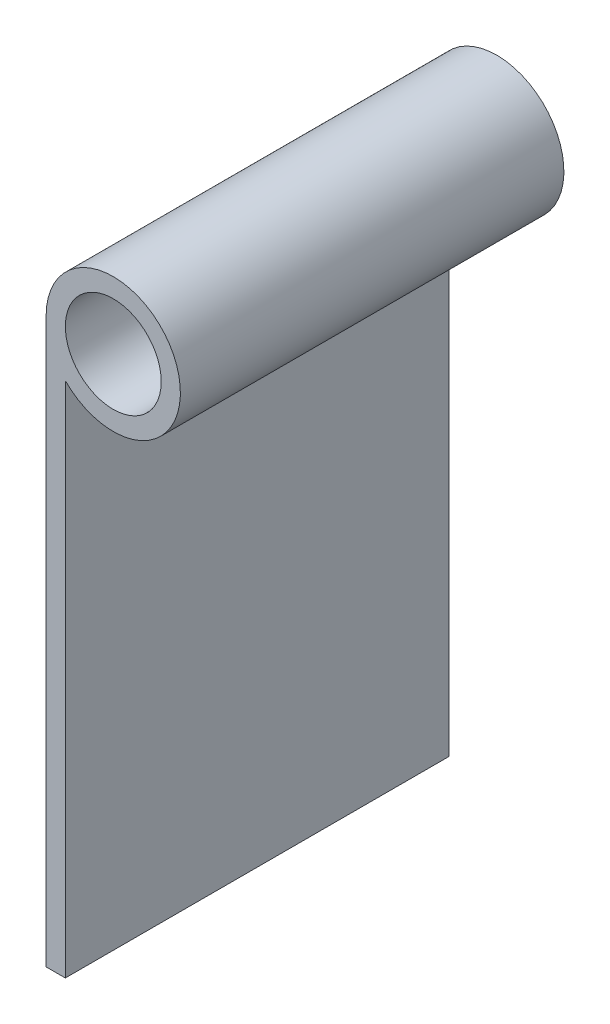
from build123d import *

# Parameters (mm, degrees)
SKETCH1_R           = 6.35
BOSS_EXTRUDE1_DEPTH = 50.8


with BuildPart() as part:
    # Sketch1 → Boss-Extrude1 (new body)
    with BuildSketch(Plane.XY):
        with BuildLine():
            Line((-8.89, 0), (-8.89, -74.75130564))
            Line((-8.89, -74.75130564), (-6.35, -74.75130564))
            Line((-6.35, -74.75130564), (-6.35, -6.221703947))
            ThreePointArc((-6.35, -6.221703947), (8.230540687, 3.360104165), (-8.89, 0))
        make_face()
        Circle(SKETCH1_R, mode=Mode.SUBTRACT)
    extrude(amount=BOSS_EXTRUDE1_DEPTH)


solid = part.part
